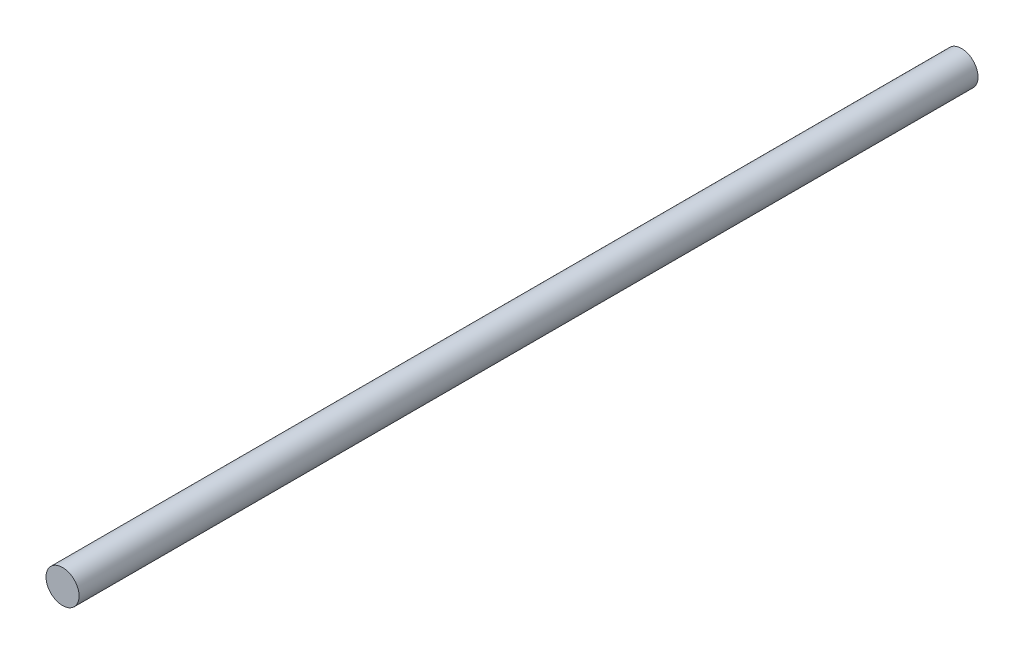
from build123d import *

# Parameters (mm, degrees)
SKETCH1_R           = 4
BOSS_EXTRUDE1_DEPTH = 217.5
SCALE1_SCALE        = 10


with BuildPart() as part:
    # Sketch1 → Boss-Extrude1 (new body)
    with BuildSketch(Plane.XY):
        with Locations(Location((0, 0, 0), (0, 0, 180))):
            Circle(SKETCH1_R)
    extrude(amount=BOSS_EXTRUDE1_DEPTH)


with BuildPart() as part_1:
    # Scale1: scaled about (0, 0, 108.75)
    add(part.part.scale(SCALE1_SCALE).moved(Location((0, 0, -978.75))))


solid = part_1.part
